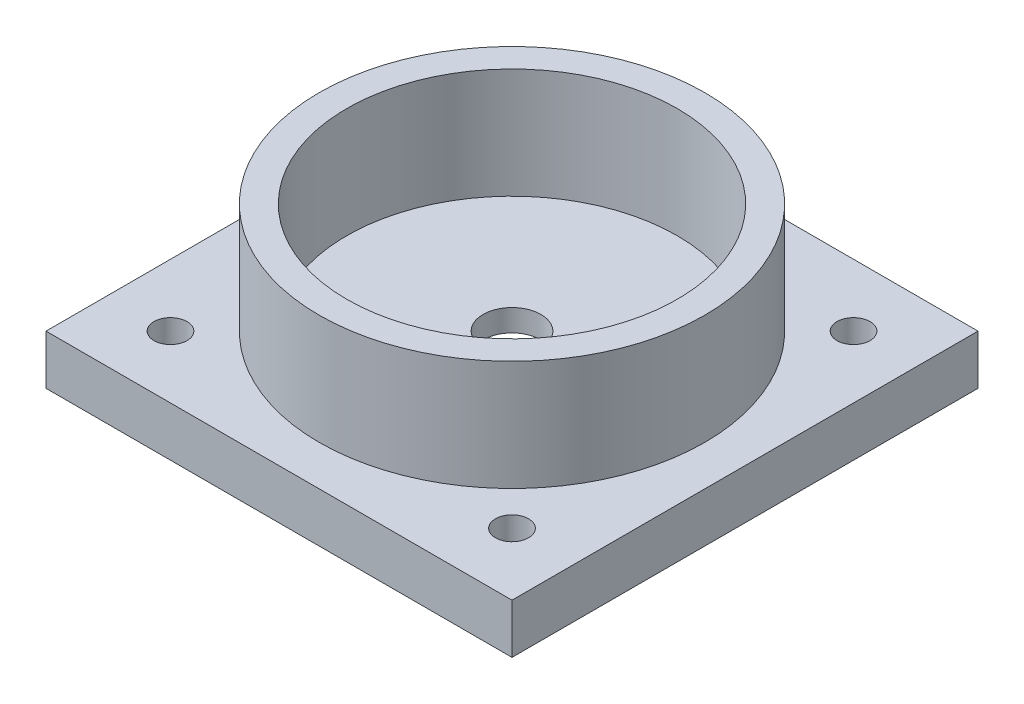
from build123d import *

# Parameters (mm, degrees)
SKETCH1_W           = 42.3
SKETCH1_H           = 42.3
SKETCH1_R           = 1.5
BOSS_EXTRUDE1_DEPTH = 4.5
SKETCH2_R           = 11
CUT_EXTRUDE1_DEPTH  = 2.5
SKETCH3_R           = 2.625
CUT_EXTRUDE2_DEPTH  = 2
SKETCH4_R           = 17.5
SKETCH4_R_2         = 15
BOSS_EXTRUDE2_DEPTH = 10


with BuildPart() as part:
    # Sketch1 → Boss-Extrude1 (new body)
    with BuildSketch(Plane(origin=(0, 0, 0), x_dir=(1, 0, 0), z_dir=(0, 1, 0))):
        Rectangle(SKETCH1_W, SKETCH1_H)
        with Locations(Location((-15.5, 15.5, 0), (0, 0, 270))):
            Circle(SKETCH1_R, mode=Mode.SUBTRACT)
        with Locations(Location((15.5, 15.5, 0), (0, 0, 270))):
            Circle(SKETCH1_R, mode=Mode.SUBTRACT)
        with Locations(Location((-15.5, -15.5, 0), (0, 0, 270))):
            Circle(SKETCH1_R, mode=Mode.SUBTRACT)
        with Locations(Location((15.5, -15.5, 0), (0, 0, 270))):
            Circle(SKETCH1_R, mode=Mode.SUBTRACT)
    extrude(amount=BOSS_EXTRUDE1_DEPTH)

    # Sketch2 → Cut-Extrude1 (cut)
    with BuildSketch(Plane.XZ):
        with Locations(Location((0, 0, 0), (0, 0, 270))):
            Circle(SKETCH2_R)
    extrude(amount=-CUT_EXTRUDE1_DEPTH, mode=Mode.SUBTRACT)

    # Sketch3 → Cut-Extrude2 (cut)
    with BuildSketch(Plane.XZ.offset(-2.5)):
        with Locations(Location((0, 0, 0), (0, 0, 270))):
            Circle(SKETCH3_R)
    extrude(amount=-CUT_EXTRUDE2_DEPTH, mode=Mode.SUBTRACT)

    # Sketch4 → Boss-Extrude2 (add)
    with BuildSketch(Plane(origin=(0, 4.5, 0), x_dir=(1, 0, 0), z_dir=(0, 1, 0))):
        with Locations(Location((0, 0, 0), (0, 0, 90))):
            Circle(SKETCH4_R)
        with Locations(Location((0, 0, 0), (0, 0, 270))):
            Circle(SKETCH4_R_2, mode=Mode.SUBTRACT)
    extrude(amount=BOSS_EXTRUDE2_DEPTH)


solid = part.part
